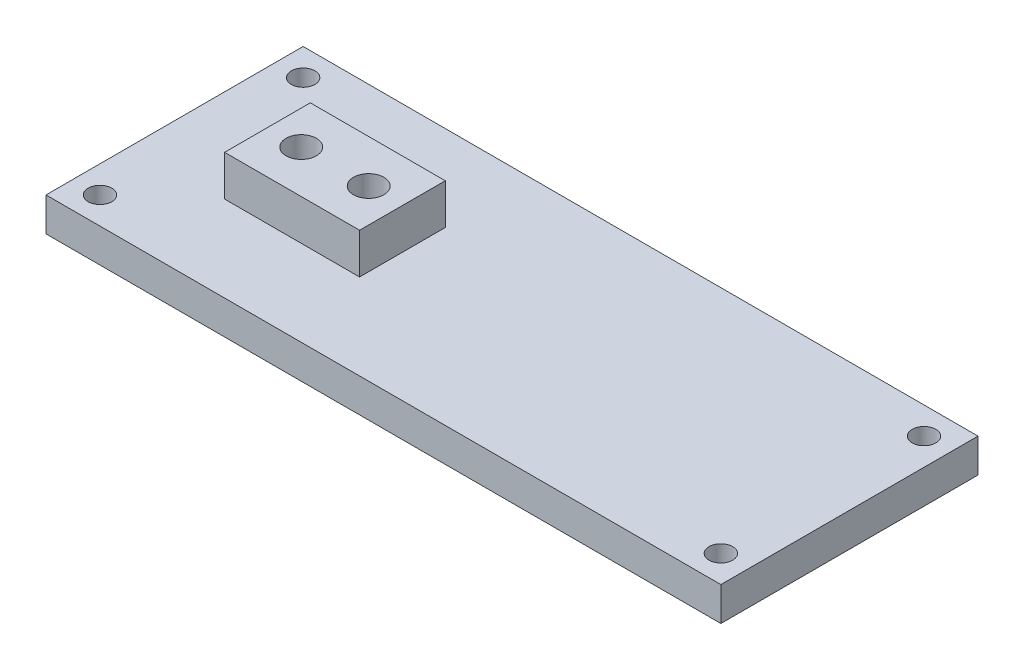
from build123d import *

# Parameters (mm, degrees)
SKETCH1_W                   = 100
SKETCH1_H                   = 38.1
BOSS_EXTRUDE1_DEPTH         = 5
SKETCH2_W                   = 20
SKETCH2_H                   = 12.7
BOSS_EXTRUDE2_DEPTH         = 6
TAP_DRILL_FOR_M4X0_7_TAP1_D = 3.3
SKETCH3_R                   = 2.25
CUT_EXTRUDE1_DEPTH          = 55.625108696
SKETCH12_R                  = 4.5
CUT_EXTRUDE2_DEPTH          = 3
SKETCH13_R                  = 1.75
CUT_EXTRUDE3_DEPTH          = 10


with BuildPart() as part:
    # Sketch1 → Boss-Extrude1 (new body)
    with BuildSketch(Plane(origin=(0, 0, 0), x_dir=(1, 0, 0), z_dir=(0, 1, 0))):
        Rectangle(SKETCH1_W, SKETCH1_H)
    extrude(amount=BOSS_EXTRUDE1_DEPTH)

    # Sketch2 → Boss-Extrude2 (add)
    with BuildSketch(Plane(origin=(0, 5, 0), x_dir=(1, 0, 0), z_dir=(0, 1, 0))):
        with Locations((-26.236645744, 0)):
            Rectangle(SKETCH2_W, SKETCH2_H)
    extrude(amount=BOSS_EXTRUDE2_DEPTH)

    # Tap Drill for M4x0.7 Tap1 (through all)
    with Locations(Plane(origin=(0, 11, 0), x_dir=(1, 0, 0), z_dir=(0, 1, 0))):
        with Locations((-31.236645744, 0), (-21.236645744, 0)):
            Hole(TAP_DRILL_FOR_M4X0_7_TAP1_D / 2)

    # Sketch3 → Cut-Extrude1 (cut, through all)
    with BuildSketch(Plane(origin=(0, 11, 0), x_dir=(1, 0, 0), z_dir=(0, 1, 0))):
        with Locations(Location((-21.236645744, 0, 0), (0, 0, 270))):
            Circle(SKETCH3_R)
        with Locations(Location((-31.236645744, 0, 0), (0, 0, 270))):
            Circle(SKETCH3_R)
    extrude(amount=-CUT_EXTRUDE1_DEPTH, mode=Mode.SUBTRACT)

    # Sketch12 → Cut-Extrude2 (cut)
    with BuildSketch(Plane.XZ):
        with Locations(Location((-31.236645744, 0, 0), (0, 0, 270))):
            Circle(SKETCH12_R)
        with Locations(Location((-21.236645744, 0, 0), (0, 0, 270))):
            Circle(SKETCH12_R)
    extrude(amount=-CUT_EXTRUDE2_DEPTH, mode=Mode.SUBTRACT)

    # Sketch13 → Cut-Extrude3 (cut)
    with BuildSketch(Plane(origin=(0, 5, 0), x_dir=(1, 0, 0), z_dir=(0, 1, 0))):
        with Locations(Location((-46, 15.05, 0), (0, 0, 270))):
            Circle(SKETCH13_R)
        with Locations(Location((-46, -15.05, 0), (0, 0, 270))):
            Circle(SKETCH13_R)
        with Locations(Location((46, -15.05, 0), (0, 0, 270))):
            Circle(SKETCH13_R)
        with Locations(Location((46, 15.05, 0), (0, 0, 270))):
            Circle(SKETCH13_R)
    extrude(amount=-CUT_EXTRUDE3_DEPTH, mode=Mode.SUBTRACT)


solid = part.part
